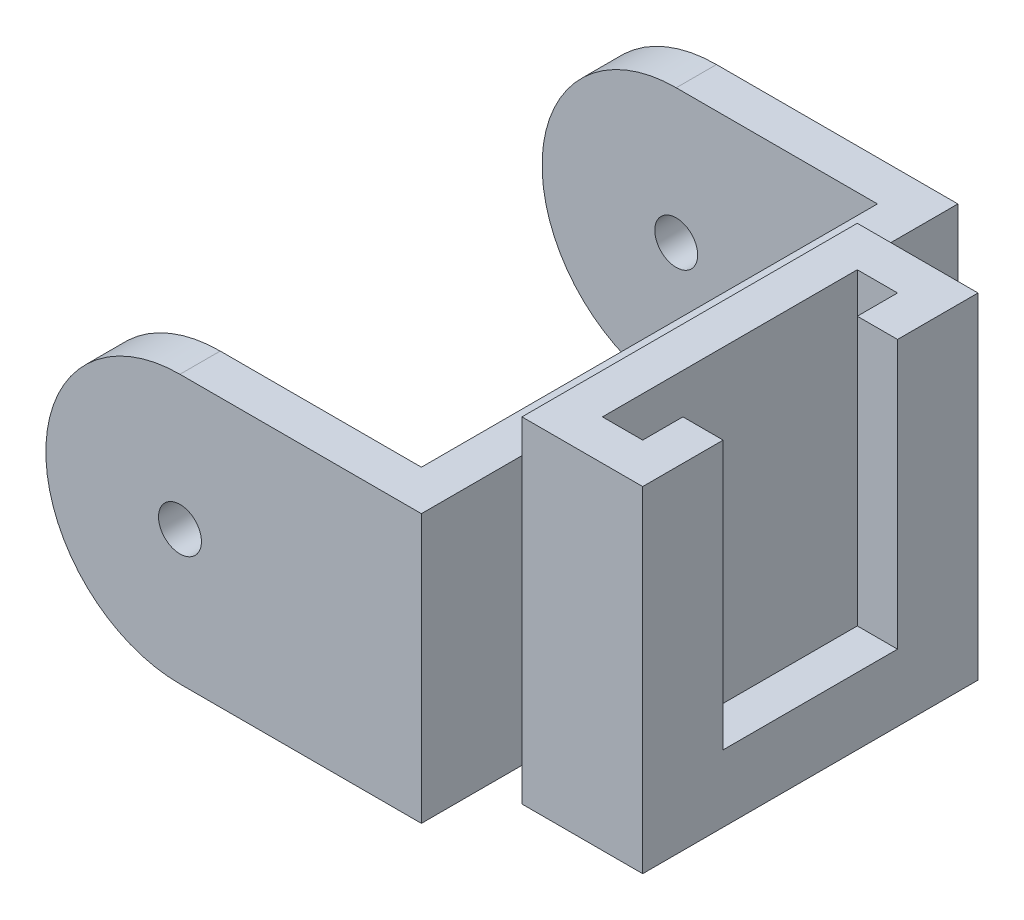
from build123d import *

# Parameters (mm, degrees)
ESQUISSE1_W             = 40
ESQUISSE1_H             = 20
BOSS_EXTRU_1_DEPTH      = 3
ESQUISSE2_W             = 3
ESQUISSE2_H             = 20
BOSS_EXTRU_2_DEPTH      = 25
ENL_V_MAT_EXTRU_1_DEPTH = 48
ESQUISSE4_R             = 1.6
ENL_V_MAT_EXTRU_2_DEPTH = 48
ESQUISSE5_W             = 25
ESQUISSE5_H             = 25
BOSS_EXTRU_3_DEPTH      = 9
ESQUISSE6_W             = 3
ESQUISSE6_H             = 19
ENL_V_MAT_EXTRU_4_DEPTH = 23
ESQUISSE8_W             = 13
ESQUISSE8_H             = 20
ENL_V_MAT_EXTRU_5_DEPTH = 3


with BuildPart() as part:
    # Esquisse1 → Boss.-Extru.1 (new body)
    with BuildSketch(Plane(origin=(0, 0, 0), x_dir=(0, 0, -1), z_dir=(1, 0, 0))):
        Rectangle(ESQUISSE1_W, ESQUISSE1_H)
    extrude(amount=BOSS_EXTRU_1_DEPTH)

    # Esquisse2 → Boss.-Extru.2 (add)
    with BuildSketch(Plane.ZY):
        with Locations((-18.5, 0)):
            Rectangle(ESQUISSE2_W, ESQUISSE2_H)
        with Locations((18.5, 0)):
            Rectangle(ESQUISSE2_W, ESQUISSE2_H)
    extrude(amount=BOSS_EXTRU_2_DEPTH)

    # Esquisse3 → Enlèv. mat.-Extru.1 (cut)
    with BuildSketch(Plane.XY.offset(20)):
        with BuildLine():
            ThreePointArc((-25, 2.7e-08), (-22.071067802, 7.071067821), (-15, 10))
            Line((-15, 10), (-25, 10))
            Line((-25, 10), (-25, 2.7e-08))
        make_face()
        with BuildLine():
            ThreePointArc((-15, -10), (-22.071067821, -7.071067802), (-25, 2.7e-08))
            Line((-25, 2.7e-08), (-25, -10))
            Line((-25, -10), (-15, -10))
        make_face()
    extrude(amount=-ENL_V_MAT_EXTRU_1_DEPTH, mode=Mode.SUBTRACT)

    # Esquisse4 → Enlèv. mat.-Extru.2 (cut)
    with BuildSketch(Plane.XY.offset(20)):
        with Locations((-15, 0)):
            Circle(ESQUISSE4_R)
    extrude(amount=-ENL_V_MAT_EXTRU_2_DEPTH, mode=Mode.SUBTRACT)

    # Esquisse5 → Boss.-Extru.3 (add)
    with BuildSketch(Plane(origin=(3, 0, 0), x_dir=(0, 0, -1), z_dir=(1, 0, 0))):
        Rectangle(ESQUISSE5_W, ESQUISSE5_H)
    extrude(amount=BOSS_EXTRU_3_DEPTH)

    # Esquisse6 → Enlèv. mat.-Extru.4 (cut)
    with BuildSketch(Plane(origin=(0, 12.5, 0), x_dir=(1, 0, 0), z_dir=(0, 1, 0))):
        with Locations((7.5, 0)):
            Rectangle(ESQUISSE6_W, ESQUISSE6_H)
    extrude(amount=-ENL_V_MAT_EXTRU_4_DEPTH, mode=Mode.SUBTRACT)

    # Esquisse8 → Enlèv. mat.-Extru.5 (cut)
    with BuildSketch(Plane(origin=(12, 0, 0), x_dir=(0, 0, -1), z_dir=(1, 0, 0))):
        with Locations((0, 2.5)):
            Rectangle(ESQUISSE8_W, ESQUISSE8_H)
    extrude(amount=-ENL_V_MAT_EXTRU_5_DEPTH, mode=Mode.SUBTRACT)


solid = part.part
